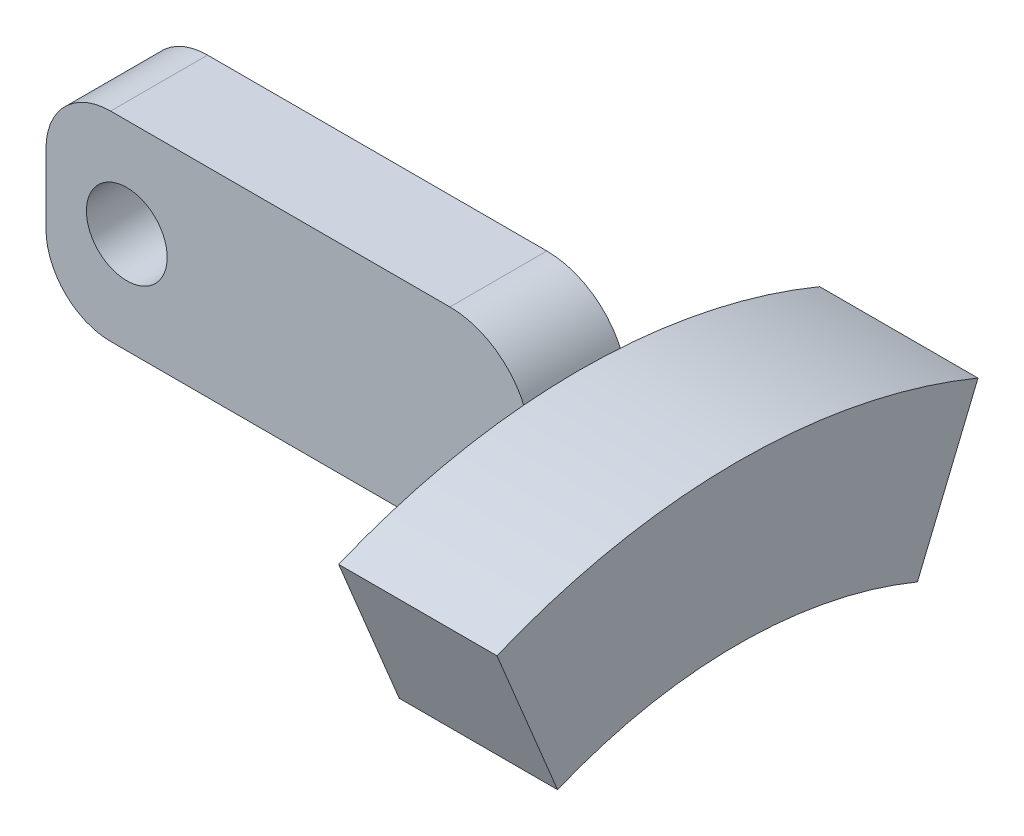
from build123d import *

# Parameters (mm, degrees)
SKETCH_1_W          = 9.8
SKETCH_1_H          = 9.8
REVOLVE_1_ANGLE     = 45
EXTRUDE_1_DEPTH     = 30
SKETCH_4_R          = 2.5
CUT_EXTRUDE_1_DEPTH = 25
FILLET_5_R          = 4
FILLET_6_R          = 5


with BuildPart() as part:
    # Эскиз1 → Повернуть1 (revolve, symmetric)
    with BuildSketch(Plane.XY) as revolve_1_sk:
        with Locations((45, 34)):
            Rectangle(SKETCH_1_W, SKETCH_1_H)
    revolve(axis=Axis((66.456117982, 0, 0), (-1, 0, 0)), revolution_arc=REVOLVE_1_ANGLE / 2)
    revolve(revolve_1_sk.sketch, axis=Axis((66.456117982, 0, 0), (1, 0, 0)), revolution_arc=REVOLVE_1_ANGLE / 2)


with BuildPart() as body_2:
    # Эскиз2 → Бобышка-Вытянуть1 (new body)
    with BuildSketch(Plane.ZY.offset(-40.1)):
        with BuildLine():
            Line((-3, 41.294403104), (-3, 28.944947746))
            ThreePointArc((-3, 28.944947746), (0, 29.1), (3, 28.944947746))
            Line((3, 28.944947746), (3, 41.294403104))
            Line((3, 41.294403104), (-3, 41.294403104))
        make_face()
    extrude(amount=EXTRUDE_1_DEPTH)

    # Эскиз4 → Вырез-Вытянуть1 (cut, symmetric)
    with BuildSketch(Plane.XY):
        with Locations(Location((15.1, 35.197201552, 0), (0, 0, 90))):
            Circle(SKETCH_4_R)
    extrude(amount=CUT_EXTRUDE_1_DEPTH, both=True, mode=Mode.SUBTRACT)

    # Скругление5
    fillet_5_edges = [body_2.edges().sort_by_distance(p)[0] for p in [
        (10.1, 29.1, 0),
        (10.1, 41.294403104, 0),
    ]]
    fillet(fillet_5_edges, radius=FILLET_5_R)

    # Скругление6
    fillet_6_edges = [body_2.edges().sort_by_distance(p)[0] for p in [
        (40.1, 41.294403104, 0),
    ]]
    fillet(fillet_6_edges, radius=FILLET_6_R)


solid = Compound([part.part, body_2.part])
